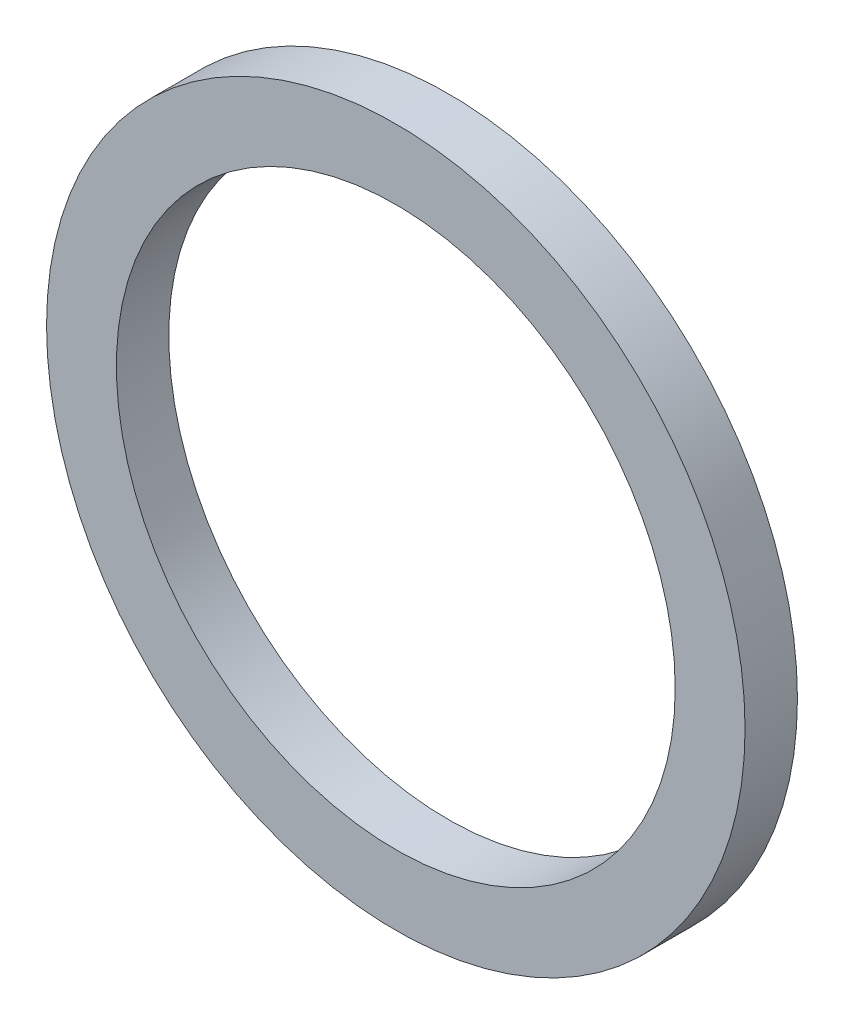
from build123d import *


with BuildPart() as part:
    # Sketch1 → Revolve1 (revolve)
    with BuildSketch(Plane(origin=(0, 0, 0), x_dir=(0, 0, -1), z_dir=(1, 0, 0)), mode=Mode.PRIVATE) as revolve1_sk:
        with BuildLine():
            Line((0, 15), (0, 12))
            Line((0, 12), (2.25, 12))
            ThreePointArc((2.25, 12), (2.53, 13.5), (2.25, 15))
            Line((2.25, 15), (0, 15))
        make_face()
    revolve(revolve1_sk.sketch.rotate(Axis((0, 0, 0), (0, 0, -1)), 90), axis=Axis((0, 0, 0), (0, 0, -1)))


solid = part.part
